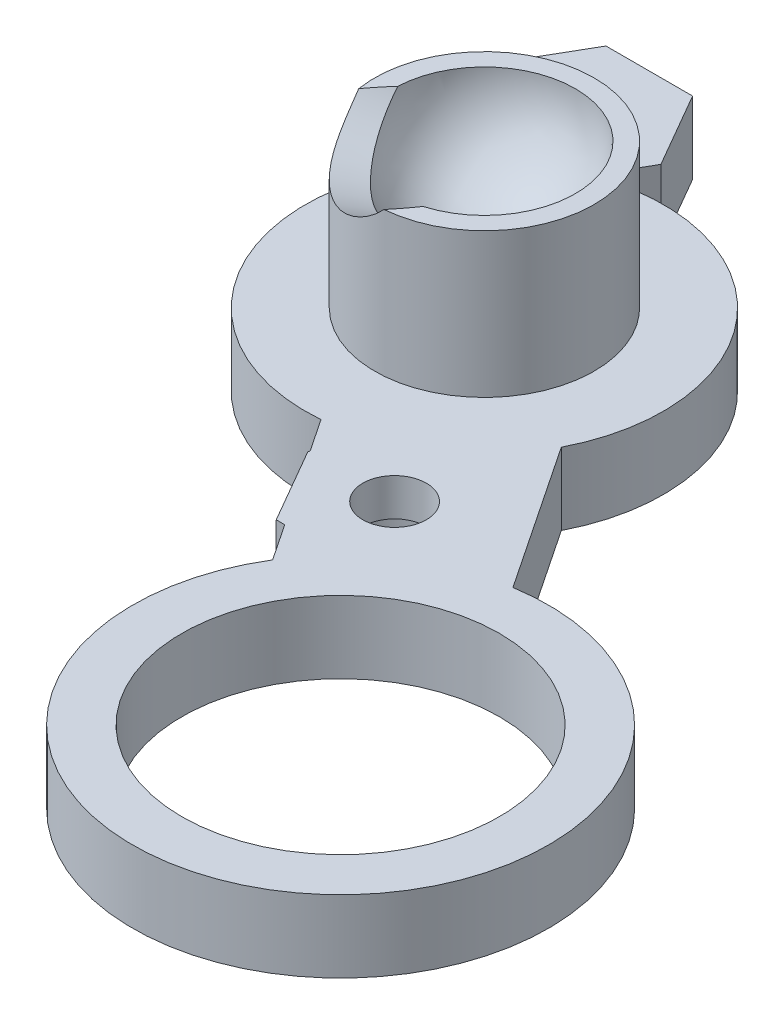
from build123d import *

# Parameters (mm, degrees)
RETAINER_FEATURE_1_PROFILE_R  = 3.8
RETAINER_FEATURE_1_DEPTH      = 5.02
RETAINER_FEATURE_2_PROFILE_R  = 6.2
RETAINER_FEATURE_2_DEPTH      = 2.5
RETAINER_FEATURE_5_DEPTH      = 2.5
RETAINER_FEATURE_8_DEPTH      = 2.5
RETAINER_FEATURE_12_DEPTH     = 2.5
RETAINER_FEATURE_13_PROFILE_R = 7.2
RETAINER_FEATURE_13_DEPTH     = 2.5
RETAINER_FEATURE_14_PROFILE_R = 5.5
RETAINER_FEATURE_14_DEPTH     = 2.7
RETAINER_FEATURE_15_PROFILE_R = 1.1
RETAINER_FEATURE_15_DEPTH     = 3.75
RETAINER_FEATURE_16_PROFILE_R = 2.1
RETAINER_FEATURE_16_DEPTH     = 1.45
RETAINER_FEATURE_17_PROFILE_R = 1.1
RETAINER_FEATURE_17_DEPTH     = 3.75
RETAINER_FEATURE_18_PROFILE_R = 2.1
RETAINER_FEATURE_18_DEPTH     = 1.45


with BuildPart() as part:
    # Retainer Feature 1 profile → Retainer Feature 1 (new body)
    with BuildSketch(Plane(origin=(0, -101, 0), x_dir=(-1, 0, 0), z_dir=(0, -1, 0))):
        with Locations(Location((30.310889132, 15, 0), (0, 0, 90))):
            Circle(RETAINER_FEATURE_1_PROFILE_R)
    extrude(amount=RETAINER_FEATURE_1_DEPTH)

    # Retainer Feature 2 profile → Retainer Feature 2 (add)
    with BuildSketch(Plane(origin=(0, -106, 0), x_dir=(-1, 0, 0), z_dir=(0, -1, 0))):
        with Locations(Location((30.310889132, 15, 0), (0, 0, 90))):
            Circle(RETAINER_FEATURE_2_PROFILE_R)
    extrude(amount=RETAINER_FEATURE_2_DEPTH)

    # Middle Right Floating Compression Ball R → Retainer Feature 5 (add)
    with BuildSketch(Plane(origin=(0, -106, 0), x_dir=(-1, 0, 0), z_dir=(0, -1, 0))):
        Polygon((31.560889132, 22.361215932), (33.060889132, 19.763139721), (36.060889132, 19.763139721), (37.560889132, 22.361215932), (36.060889132, 24.959292144), (33.060889132, 24.959292144), align=None)
    extrude(amount=RETAINER_FEATURE_5_DEPTH)

    # Middle Right Floating Compression Ba 2 → Retainer Feature 8 (add)
    with BuildSketch(Plane(origin=(0, -106, 0), x_dir=(-1, 0, 0), z_dir=(0, -1, 0))):
        Polygon((23.060889132, 7.638784068), (24.560889132, 5.040707856), (27.560889132, 5.040707856), (29.060889132, 7.638784068), (27.560889132, 10.236860279), (24.560889132, 10.236860279), align=None)
    extrude(amount=RETAINER_FEATURE_8_DEPTH)

    # Retainer Feature 9 profile → Retainer Feature 9 (revolve, cut)
    with BuildSketch(Plane(origin=(0, -101, 0), x_dir=(-1, 0, 0), z_dir=(0, -1, 0))):
        with BuildLine():
            Line((30.310889132, 11.85), (30.310889132, 18.15))
            ThreePointArc((30.310889132, 18.15), (27.160889132, 15), (30.310889132, 11.85))
        make_face()
    revolve(axis=Axis((-30.310889132, -101, -25), (0, 0, 1)), mode=Mode.SUBTRACT)

    # Middle Right Floating Compression Ba 3 → Retainer Feature 12 (add)
    with BuildSketch(Plane(origin=(0, -106, 0), x_dir=(-1, 0, 0), z_dir=(0, -1, 0))):
        Polygon((27.816215917, 16.66631496), (17.79697803, 1.66631496), (22.786324462, -1.66631496), (32.805562348, 13.33368504), align=None)
    extrude(amount=RETAINER_FEATURE_12_DEPTH)

    # Retainer Feature 13 profile → Retainer Feature 13 (add)
    with BuildSketch(Plane(origin=(0, -106, 0), x_dir=(-1, 0, 0), z_dir=(0, -1, 0))):
        with Locations((20.291651246, 0)):
            Circle(RETAINER_FEATURE_13_PROFILE_R)
    extrude(amount=RETAINER_FEATURE_13_DEPTH)

    # Retainer Feature 14 profile → Retainer Feature 14 (cut)
    with BuildSketch(Plane(origin=(0, -105.9, 0), x_dir=(-1, 0, 0), z_dir=(0, -1, 0))):
        with Locations(Location((20.291651246, 0, 0), (0, 0, 270))):
            Circle(RETAINER_FEATURE_14_PROFILE_R)
    extrude(amount=RETAINER_FEATURE_14_DEPTH, mode=Mode.SUBTRACT)

    # Retainer Feature 15 profile → Retainer Feature 15 (cut)
    with BuildSketch(Plane(origin=(0, -105, 0), x_dir=(-1, 0, 0), z_dir=(0, -1, 0))):
        with Locations(Location((34.560889132, 22.361215932, 0), (0, 0, 90))):
            Circle(RETAINER_FEATURE_15_PROFILE_R)
    extrude(amount=RETAINER_FEATURE_15_DEPTH, mode=Mode.SUBTRACT)

    # Retainer Feature 16 profile → Retainer Feature 16 (cut)
    with BuildSketch(Plane(origin=(0, -107.3, 0), x_dir=(-1, 0, 0), z_dir=(0, -1, 0))):
        with Locations(Location((34.560889132, 22.361215932, 0), (0, 0, 90))):
            Circle(RETAINER_FEATURE_16_PROFILE_R)
    extrude(amount=RETAINER_FEATURE_16_DEPTH, mode=Mode.SUBTRACT)

    # Retainer Feature 17 profile → Retainer Feature 17 (cut)
    with BuildSketch(Plane(origin=(0, -105, 0), x_dir=(-1, 0, 0), z_dir=(0, -1, 0))):
        with Locations(Location((26.060889132, 7.638784068, 0), (0, 0, 90))):
            Circle(RETAINER_FEATURE_17_PROFILE_R)
    extrude(amount=RETAINER_FEATURE_17_DEPTH, mode=Mode.SUBTRACT)

    # Retainer Feature 18 profile → Retainer Feature 18 (cut)
    with BuildSketch(Plane(origin=(0, -107.3, 0), x_dir=(-1, 0, 0), z_dir=(0, -1, 0))):
        with Locations(Location((26.060889132, 7.638784068, 0), (0, 0, 90))):
            Circle(RETAINER_FEATURE_18_PROFILE_R)
    extrude(amount=RETAINER_FEATURE_18_DEPTH, mode=Mode.SUBTRACT)

    # Articulation Throat Sketch → Articulation Throat (revolve, cut)
    with BuildSketch(Plane(origin=(-55.559435073, -21.315405316, -26.260716517), x_dir=(0.37694407644157146, 0.1446147852349051, -0.9148768917876727), z_dir=(0.8541721659092646, 0.32770358269776195, 0.4037329227012915))):
        Polygon((-12.308450042, -83.441173866), (-10.724100051, -81.773890115), (-22.767880189, -61.059022025), (-28.981287547, -67.597673951), align=None)
    revolve(axis=Axis((-25.110986143, -106.383086561, -21.631997284), (-0.5199902989343897, 0.5383086561091633, 0.6631997284167648)), mode=Mode.SUBTRACT)


solid = part.part
